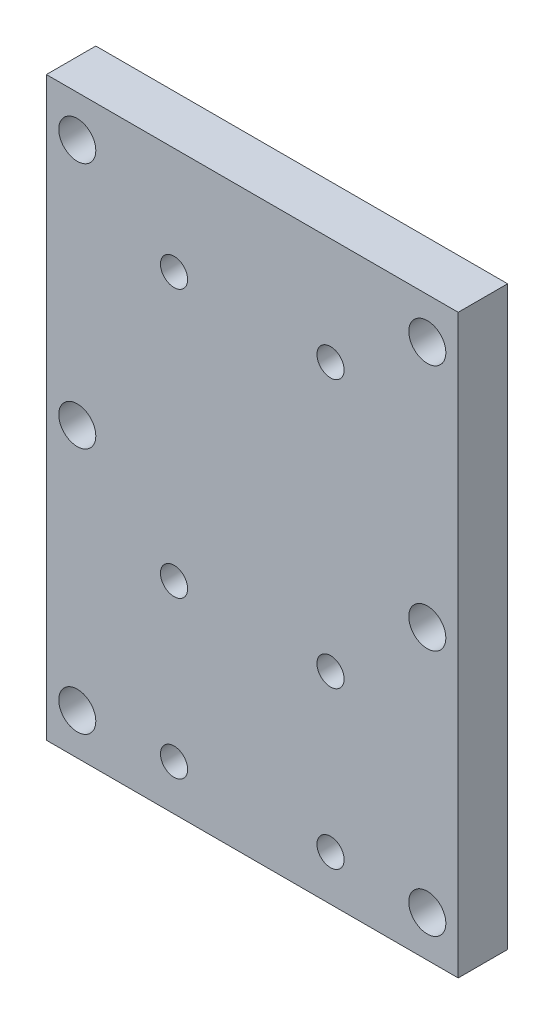
from build123d import *

# Parameters (mm, degrees)
SKETCH_1_W                  = 100
SKETCH_1_H                  = 140
SKETCH_1_R                  = 4.5
EXTRUDE_1_DEPTH             = 12
HOLE_WIZARD_1_D             = 6.6
HOLE_WIZARD_1_CBORE_D       = 11
HOLE_WIZARD_1_CBORE_DEPTH   = 6.8
PATTERN_LINEAR_1_COUNT      = 2
PATTERN_LINEAR_1_PITCH      = 38
PATTERN_LINEAR_1_COUNT_DIR2 = 2
PATTERN_LINEAR_1_PITCH_DIR2 = 38
HOLE_WIZARD_0_D             = 6.6
HOLE_WIZARD_0_CBORE_D       = 11
HOLE_WIZARD_0_CBORE_DEPTH   = 6.8
PATTERN_LINEAR_2_COUNT      = 2
PATTERN_LINEAR_2_PITCH      = 38


with BuildPart() as part:
    # 草图1 → 凸台-拉伸1 (new body)
    with BuildSketch(Plane.XY):
        Rectangle(SKETCH_1_W, SKETCH_1_H)
        with Locations((-42.5, -60)):
            Circle(SKETCH_1_R, mode=Mode.SUBTRACT)
        with Locations((42.5, -60)):
            Circle(SKETCH_1_R, mode=Mode.SUBTRACT)
        with Locations((42.5, 0)):
            Circle(SKETCH_1_R, mode=Mode.SUBTRACT)
        with Locations((42.5, 60)):
            Circle(SKETCH_1_R, mode=Mode.SUBTRACT)
        with Locations((-42.5, 0)):
            Circle(SKETCH_1_R, mode=Mode.SUBTRACT)
        with Locations((-42.5, 60)):
            Circle(SKETCH_1_R, mode=Mode.SUBTRACT)
    extrude(amount=EXTRUDE_1_DEPTH)

    # 打孔尺寸(%根据)内六角圆柱头螺钉的类型1 (through all)
    with Locations(Plane(origin=(0, 0, 0), x_dir=(-1, 0, 0), z_dir=(0, 0, -1))):
        with Locations((-19, -59)):
            hole_wizard_1 = CounterBoreHole(HOLE_WIZARD_1_D / 2, HOLE_WIZARD_1_CBORE_D / 2, HOLE_WIZARD_1_CBORE_DEPTH)

    # 阵列(线性)1: Hole Wizard 1 2 × 2
    with Locations(*[(-j * PATTERN_LINEAR_1_PITCH_DIR2, i * PATTERN_LINEAR_1_PITCH, 0) for i in range(PATTERN_LINEAR_1_COUNT) for j in range(PATTERN_LINEAR_1_COUNT_DIR2) if (i, j) != (0, 0)]):
        add(hole_wizard_1, mode=Mode.SUBTRACT)

    # 打孔尺寸(%根据)内六角圆柱头螺钉的类型0 (through all)
    with Locations(Plane(origin=(0, 0, 0), x_dir=(-1, 0, 0), z_dir=(0, 0, -1))):
        with Locations((-19, 44)):
            hole_wizard_0 = CounterBoreHole(HOLE_WIZARD_0_D / 2, HOLE_WIZARD_0_CBORE_D / 2, HOLE_WIZARD_0_CBORE_DEPTH)

    # 阵列(线性)2: 打孔尺寸(%根据)内六角圆柱头螺钉的类型0 ×2
    with Locations(*[(-i * PATTERN_LINEAR_2_PITCH, 0, 0) for i in range(1, PATTERN_LINEAR_2_COUNT)]):
        add(hole_wizard_0, mode=Mode.SUBTRACT)


solid = part.part
